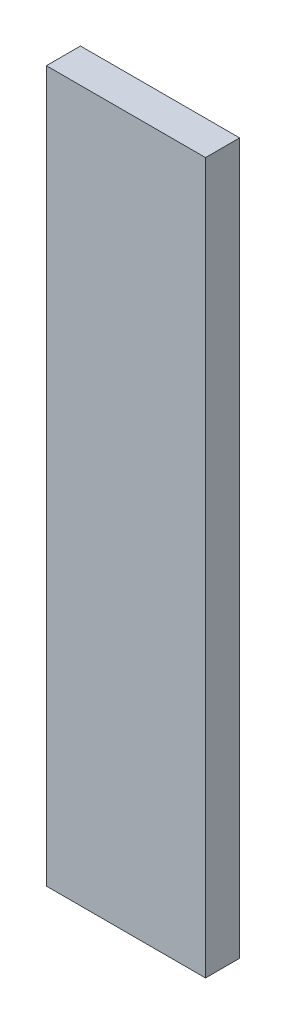
from build123d import *

# Parameters (mm, degrees)
CROQUIS1_W              = 28
CROQUIS1_H              = 125
SALIENTE_EXTRUIR1_DEPTH = 6


with BuildPart() as part:
    # Croquis1 → Saliente-Extruir1 (new body)
    with BuildSketch(Plane.XY):
        with Locations((14, 62.5)):
            Rectangle(CROQUIS1_W, CROQUIS1_H)
    extrude(amount=SALIENTE_EXTRUIR1_DEPTH)


solid = part.part
